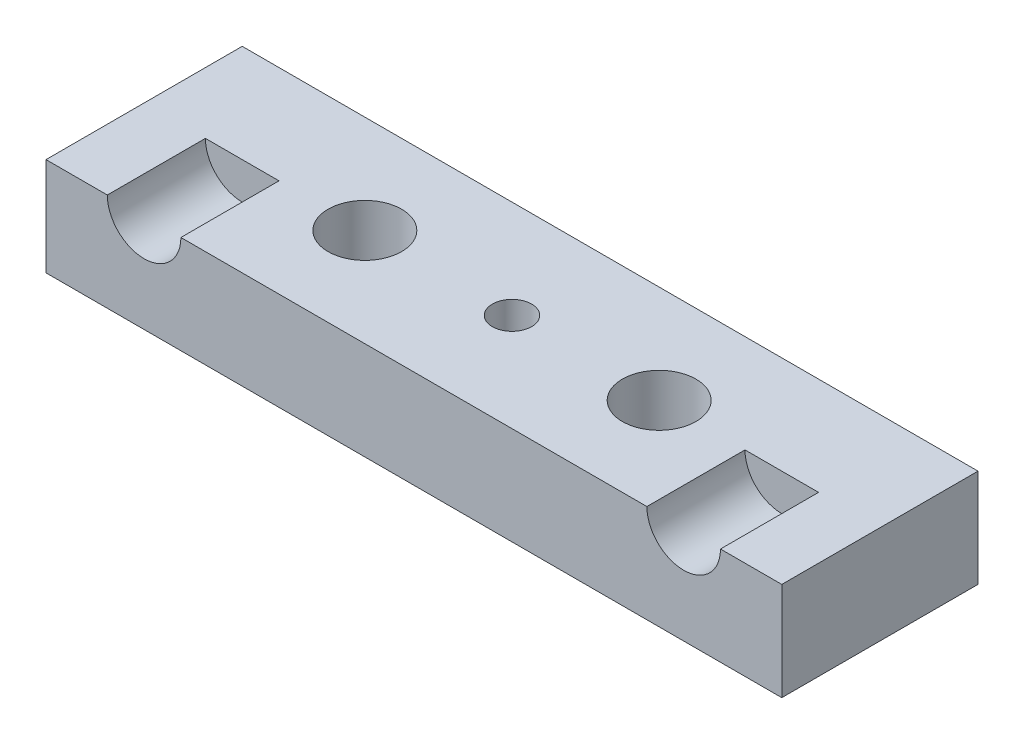
from build123d import *

# Parameters (mm, degrees)
CROQUIS1_W     = 150
CROQUIS1_H     = 40
EXTRUIR1_DEPTH = 20
CROQUIS4_R     = 7.5
CROQUIS4_R_2   = 4
EXTRUIR3_DEPTH = 81.156097709
CROQUIS5_R     = 7.5
EXTRUIR4_DEPTH = 20


with BuildPart() as part:
    # Croquis1 → Extruir1 (new body)
    with BuildSketch(Plane(origin=(0, 0, 0), x_dir=(1, 0, 0), z_dir=(0, 1, 0))):
        Rectangle(CROQUIS1_W, CROQUIS1_H)
    extrude(amount=EXTRUIR1_DEPTH)

    # Croquis4 → Extruir3 (cut, through all)
    with BuildSketch(Plane(origin=(0, 20, 0), x_dir=(1, 0, 0), z_dir=(0, 1, 0))):
        with Locations(Location((-30, 0, 0), (0, 0, 270))):
            Circle(CROQUIS4_R)
        with Locations(Location((30, 0, 0), (0, 0, 90))):
            Circle(CROQUIS4_R)
        with Locations(Location((0, 0, 0), (0, 0, 270))):
            Circle(CROQUIS4_R_2)
    extrude(amount=-EXTRUIR3_DEPTH, mode=Mode.SUBTRACT)

    # Croquis5 → Extruir4 (cut)
    with BuildSketch(Plane.XY.offset(20)):
        with Locations((-55, 20)):
            Circle(CROQUIS5_R)
        with Locations((55, 20)):
            Circle(CROQUIS5_R)
    extrude(amount=-EXTRUIR4_DEPTH, mode=Mode.SUBTRACT)


solid = part.part
